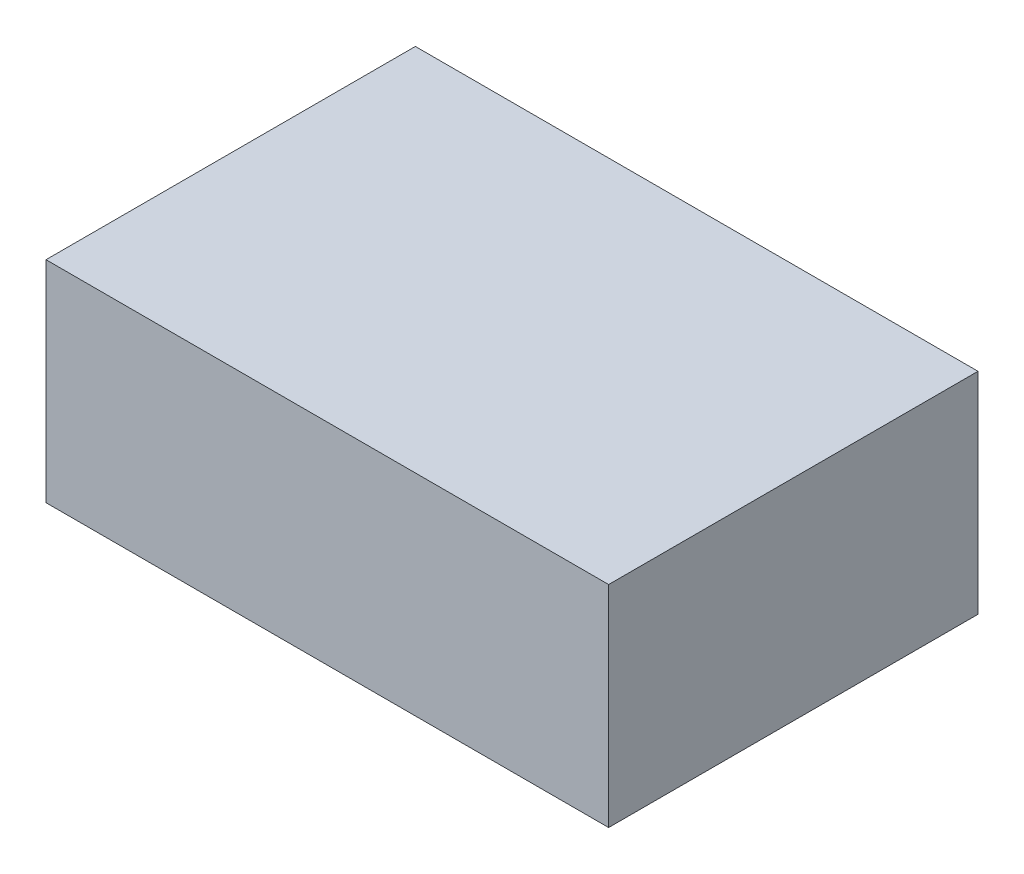
from build123d import *

# Parameters (mm, degrees)
SKETCH1_W           = 27.432
SKETCH1_H           = 18.0086
BOSS_EXTRUDE1_DEPTH = 10.2616
CUT_EXTRUDE1_DEPTH  = 5.08


with BuildPart() as part:
    # Sketch1 → Boss-Extrude1 (new body)
    with BuildSketch(Plane(origin=(0, 0, 0), x_dir=(1, 0, 0), z_dir=(0, 1, 0))):
        Rectangle(SKETCH1_W, SKETCH1_H)
    extrude(amount=BOSS_EXTRUDE1_DEPTH)

    # Sketch2 → Cut-Extrude1 (cut)
    with BuildSketch(Plane.XZ):
        Polygon((-0.5969, 0.5969), (-0.5969, 1.9685), (0.5969, 1.9685), (0.5969, 0.5969), (1.9685, 0.5969), (1.9685, -0.5969), (0.5969, -0.5969), (0.5969, -1.9685), (-0.5969, -1.9685), (-0.5969, -0.5969), (-1.9685, -0.5969), (-1.9685, 0.5969), align=None)
    extrude(amount=-CUT_EXTRUDE1_DEPTH, mode=Mode.SUBTRACT)


solid = part.part
